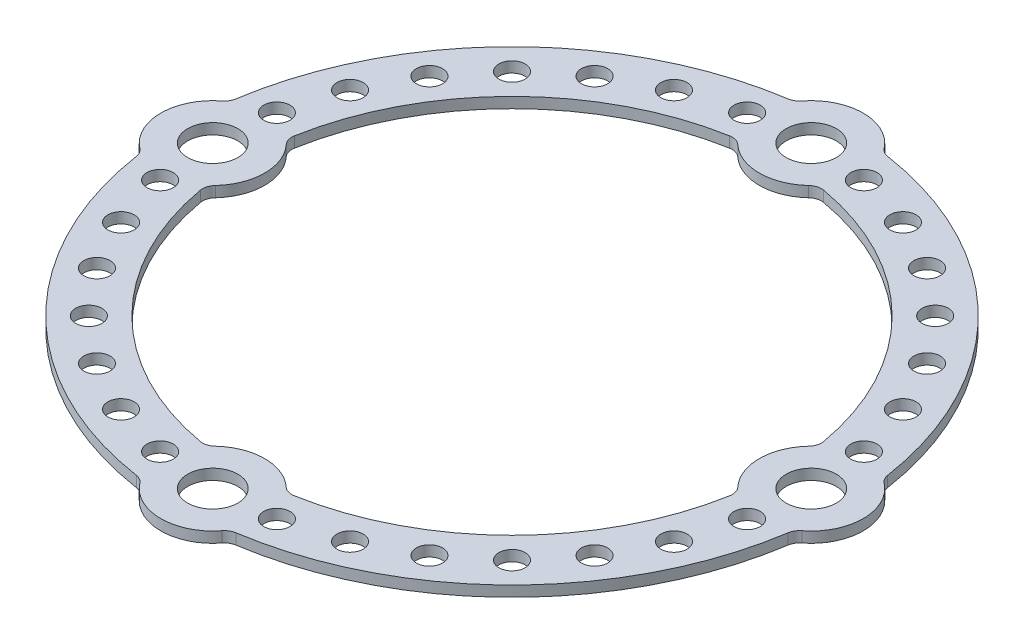
from build123d import *

# Parameters (mm, degrees)
SKETCH1_R                = 49
SKETCH1_R_2              = 39.95
SKETCH1_R_3              = 3.725
BOSS_EXTRUDE1_DEPTH      = 1.5875
BOSS_EXTRUDE3_START      = -1.5875
SKETCH2_R                = 7.725
SKETCH2_R_2              = 3.725
BOSS_EXTRUDE3_DEPTH      = 1.5875
FILLET1_R                = 2
CIRPATTERN1_COUNT        = 4
FILLET1_OF_CIRPATTERN1_R = 2
SKETCH4_R                = 1.95
CUT_EXTRUDE3_DEPTH       = 1.5875
CIRPATTERN2_COUNT        = 32


with BuildPart() as part:
    # Sketch1 → Boss-Extrude1 (new body)
    with BuildSketch(Plane(origin=(0, 0, 0), x_dir=(1, 0, 0), z_dir=(0, 1, 0))):
        with Locations(Location((0, 0, 0), (0, 0, 270))):
            Circle(SKETCH1_R)
        with Locations(Location((0, 0, 0), (0, 0, 270))):
            Circle(SKETCH1_R_2, mode=Mode.SUBTRACT)
        with Locations(Location((0, 44.475, 0), (0, 0, 270))):
            Circle(SKETCH1_R_3, mode=Mode.SUBTRACT)
        with Locations(Location((44.475, 0, 0), (0, 0, 270))):
            Circle(SKETCH1_R_3, mode=Mode.SUBTRACT)
        with Locations(Location((0, -44.475, 0), (0, 0, 270))):
            Circle(SKETCH1_R_3, mode=Mode.SUBTRACT)
        with Locations(Location((-44.475, 0, 0), (0, 0, 270))):
            Circle(SKETCH1_R_3, mode=Mode.SUBTRACT)
    extrude(amount=BOSS_EXTRUDE1_DEPTH)

    # Sketch2 → Boss-Extrude3 (add)
    with BuildSketch(Plane(origin=(0, 1.5875, 0), x_dir=(1, 0, 0), z_dir=(0, 1, 0)).offset(BOSS_EXTRUDE3_START)):
        with Locations((-44.475, 0)):
            Circle(SKETCH2_R)
        with Locations(Location((-44.475, 0, 0), (0, 0, 270))):
            Circle(SKETCH2_R_2, mode=Mode.SUBTRACT)
    boss_extrude3 = extrude(amount=BOSS_EXTRUDE3_DEPTH)

    # Fillet1
    fillet1_edges = [part.edges().sort_by_distance(p)[0] for p in [
        (-39.509302979, 0.79375, 5.917556768),
        (-39.509302979, 0.79375, -5.917556768),
        (-48.559302979, 0.79375, -6.556988194),
        (-48.559302979, 0.79375, 6.556988194),
    ]]
    fillet(fillet1_edges, radius=FILLET1_R)

    # CirPattern1: Boss-Extrude3 ×4 about axis
    cirpattern1_axis = Axis((0, 0, 0), (0, 1, 0))
    for i in range(1, CIRPATTERN1_COUNT):
        add(boss_extrude3.rotate(cirpattern1_axis, i * 360 / CIRPATTERN1_COUNT))

    # Fillet1 of CirPattern1
    fillet1_of_cirpattern1_edges = [part.edges().sort_by_distance(p)[0] for p in [
        (5.917556768, 0.79375, 39.509302979),
        (-5.917556768, 0.79375, 39.509302979),
        (-6.556988194, 0.79375, 48.559302979),
        (6.556988194, 0.79375, 48.559302979),
        (39.509302979, 0.79375, -5.917556768),
        (39.509302979, 0.79375, 5.917556768),
        (48.559302979, 0.79375, 6.556988194),
        (48.559302979, 0.79375, -6.556988194),
        (-5.917556768, 0.79375, -39.509302979),
        (5.917556768, 0.79375, -39.509302979),
        (6.556988194, 0.79375, -48.559302979),
        (-6.556988194, 0.79375, -48.559302979),
    ]]
    fillet(fillet1_of_cirpattern1_edges, radius=FILLET1_OF_CIRPATTERN1_R)

    # Sketch4 → Cut-Extrude3 (cut)
    with BuildSketch(Plane(origin=(0, 1.5875, 0), x_dir=(1, 0, 0), z_dir=(0, 1, 0))):
        with Locations(Location((-31.448574093, 31.448574093, 0), (0, 0, 270))):
            Circle(SKETCH4_R)
    cut_extrude3 = extrude(amount=-CUT_EXTRUDE3_DEPTH, mode=Mode.SUBTRACT)

    # CirPattern2: Cut-Extrude3 ×32 about axis
    cirpattern2_axis = Axis((0, 0, 0), (0, 1, 0))
    for i in range(1, CIRPATTERN2_COUNT):
        add(cut_extrude3.rotate(cirpattern2_axis, i * 360 / CIRPATTERN2_COUNT), mode=Mode.SUBTRACT)


solid = part.part
